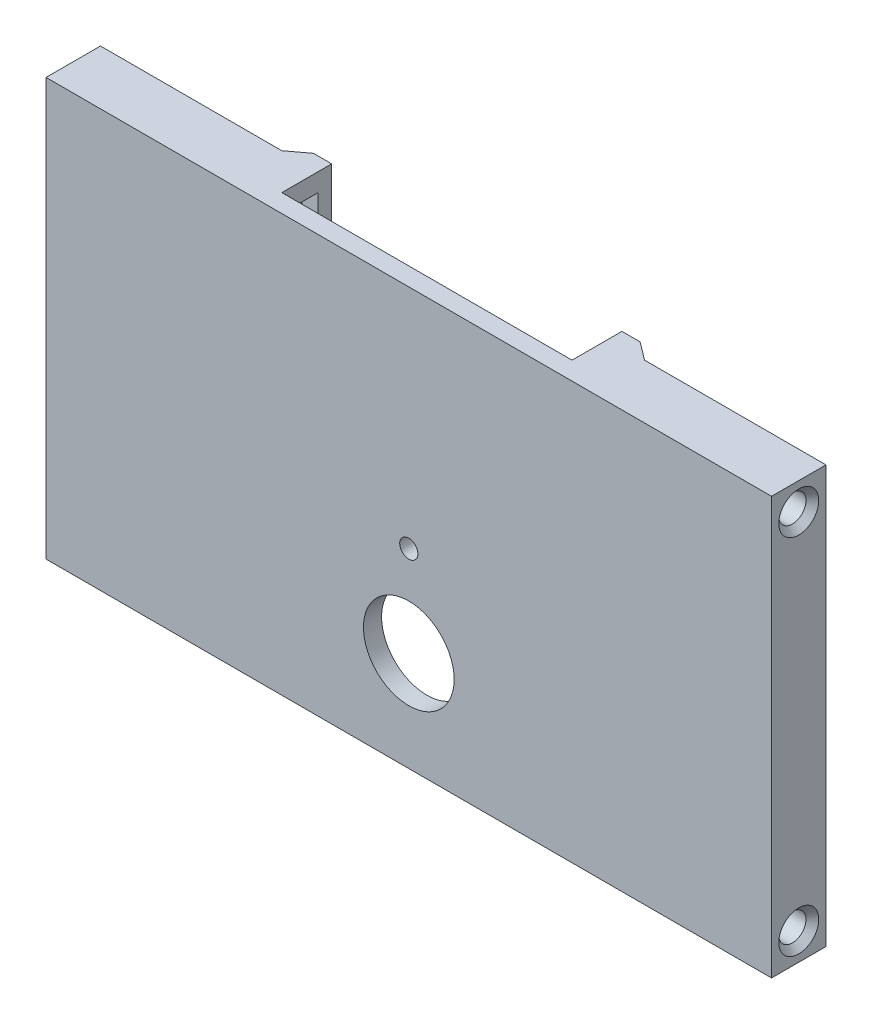
from build123d import *

# Parameters (mm, degrees)
AUFSATZ_LINEAR_AUSTRAGEN1_DEPTH         = 3
AUFSATZ_LINEAR_AUSTRAGEN1_DEPTH_BACK    = 3
SKIZZE1_W                               = 80
SKIZZE1_H                               = 46
SKIZZE1_R                               = 5
SKIZZE1_R_2                             = 1
F_3_0_3_DURCHMESSER_BOHRUNG1_AT_2_COUNT = 2
F_3_0_3_DURCHMESSER_BOHRUNG1_AT_2_PITCH = 40
SKIZZE4_W                               = 32
SKIZZE4_H                               = 46
SCHNITT_LINEAR_AUSTRAGEN1_DEPTH         = 4
SCHNITT_LINEAR_AUSTRAGEN3_DEPTH         = 4.5
SKIZZE9_W                               = 35.5
SKIZZE9_H                               = 44
SCHNITT_LINEAR_AUSTRAGEN5_DEPTH         = 2
AUFSATZ_LINEAR_AUSTRAGEN2_DEPTH         = 34
FASE1_SIZE                              = 0.7


with BuildPart() as part:
    # Skizze1 → Aufsatz-Linear austragen1 (new, two sides: drawn at the far end of the back side and taken through both)
    with BuildSketch(Plane.XY.offset(-AUFSATZ_LINEAR_AUSTRAGEN1_DEPTH_BACK)):
        Rectangle(SKIZZE1_W, SKIZZE1_H)
        with Locations((0, -12)):
            Circle(SKIZZE1_R, mode=Mode.SUBTRACT)
        with Locations((0, -2)):
            Circle(SKIZZE1_R_2, mode=Mode.SUBTRACT)
    extrude(amount=AUFSATZ_LINEAR_AUSTRAGEN1_DEPTH + AUFSATZ_LINEAR_AUSTRAGEN1_DEPTH_BACK)

    # Skizze2 → Ø3.0 (3) Durchmesser Bohrung1 (revolve, cut)
    with BuildSketch(Plane(origin=(40, -20, 0), x_dir=(0, 0, -1), z_dir=(0, 1, 0))):
        Polygon((0, 0), (0, 12.901290929), (1.5, 12), (1.5, 0), align=None)
    f_3_0_3_durchmesser_bohrung1 = revolve(axis=Axis((46.35, -20, 0), (-1, 0, 0)), mode=Mode.SUBTRACT)

    # Ø3.0 (3) Durchmesser Bohrung1 at 2: Ø3.0 (3) Durchmesser Bohrung1 ×2
    with Locations(*[(0, i * F_3_0_3_DURCHMESSER_BOHRUNG1_AT_2_PITCH, 0) for i in range(1, F_3_0_3_DURCHMESSER_BOHRUNG1_AT_2_COUNT)]):
        add(f_3_0_3_durchmesser_bohrung1, mode=Mode.SUBTRACT)

    # Spiegeln1: Ø3.0 (3) Durchmesser Bohrung1 across plane
    add(f_3_0_3_durchmesser_bohrung1.mirror(Plane(origin=(0, 0, 0), x_dir=(0, 0, 1), z_dir=(1, 0, 0))), mode=Mode.SUBTRACT)

    # Spiegeln1 copy 1 sketch → Spiegeln1 copy 1 (revolve, cut)
    with BuildSketch(Plane(origin=(-40, 20, 0), x_dir=(0, 0, -1), z_dir=(0, 1, 0))):
        Polygon((0, 0), (0, -12.901290929), (1.5, -12), (1.5, 0), align=None)
    revolve(axis=Axis((-46.35, 20, 0), (-1, 0, 0)), mode=Mode.SUBTRACT)

    # Skizze4 → Schnitt-Linear austragen1 (cut)
    with BuildSketch(Plane.XY.offset(-3)):
        Rectangle(SKIZZE4_W, SKIZZE4_H)
    extrude(amount=SCHNITT_LINEAR_AUSTRAGEN1_DEPTH, mode=Mode.SUBTRACT)

    # Skizze6 → Schnitt-Linear austragen3 (cut)
    with BuildSketch(Plane(origin=(0, 0, -3), x_dir=(-1, 0, 0), z_dir=(0, 0, -1))):
        with BuildLine():
            Line((37, 15), (37, -15))
            ThreePointArc((37, -15), (36.414213562, -16.414213562), (35, -17))
            Line((35, -17), (22, -17))
            ThreePointArc((22, -17), (20.585786438, -16.414213562), (20, -15))
            Line((20, -15), (20, 15))
            ThreePointArc((20, 15), (20.585786438, 16.414213562), (22, 17))
            Line((22, 17), (35, 17))
            ThreePointArc((35, 17), (36.414213562, 16.414213562), (37, 15))
        make_face()
        with BuildLine():
            Line((-35, 17), (-22, 17))
            ThreePointArc((-22, 17), (-20.585786438, 16.414213562), (-20, 15))
            Line((-20, 15), (-20, -15))
            ThreePointArc((-20, -15), (-20.585786438, -16.414213562), (-22, -17))
            Line((-22, -17), (-35, -17))
            ThreePointArc((-35, -17), (-36.414213562, -16.414213562), (-37, -15))
            Line((-37, -15), (-37, 15))
            ThreePointArc((-37, 15), (-36.414213562, 16.414213562), (-35, 17))
        make_face()
    extrude(amount=-SCHNITT_LINEAR_AUSTRAGEN3_DEPTH, mode=Mode.SUBTRACT)

    # Skizze9 → Schnitt-Linear austragen5 (cut)
    with BuildSketch(Plane(origin=(0, 0, -3), x_dir=(-1, 0, 0), z_dir=(0, 0, -1))):
        with Locations((0, -1)):
            Rectangle(SKIZZE9_W, SKIZZE9_H)
    extrude(amount=-SCHNITT_LINEAR_AUSTRAGEN5_DEPTH, mode=Mode.SUBTRACT)

    # Skizze10 → Aufsatz-Linear austragen2 (add)
    with BuildSketch(Plane(origin=(0, 23, 0), x_dir=(1, 0, 0), z_dir=(0, 1, 0))):
        Polygon((-16, 3), (-16, 4.5), (-18, 4.5), (-20, 3), align=None)
        Polygon((20, 3), (16, 3), (16, 4.5), (18, 4.5), align=None)
    extrude(amount=-AUFSATZ_LINEAR_AUSTRAGEN2_DEPTH)

    # Fase1
    fase1_edges = [part.edges().sort_by_distance(p)[0] for p in [
        (40, 20, 1.5),
        (40, -20, 1.5),
        (-40, 20, 1.5),
        (-40, -20, 1.5),
    ]]
    chamfer(fase1_edges, length=FASE1_SIZE)


solid = part.part
